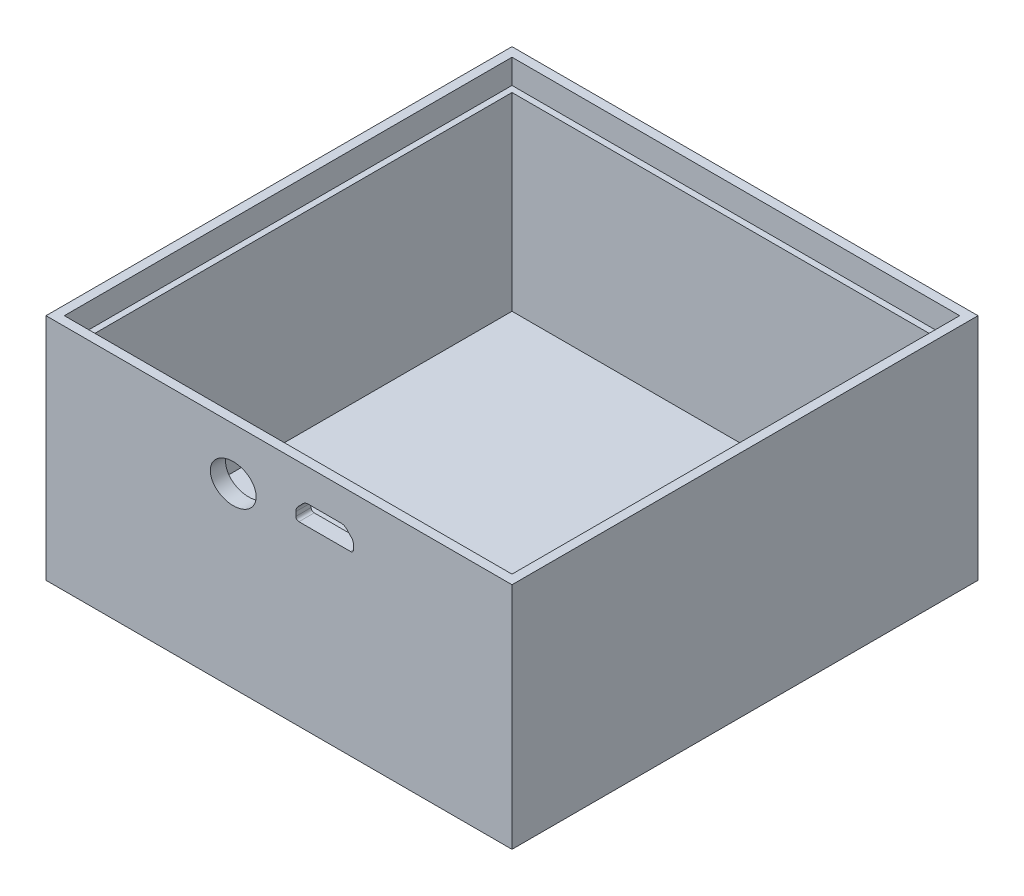
from build123d import *

# Parameters (mm, degrees)
SKETCH1_W           = 61
SKETCH1_H           = 61
SKETCH1_W_2         = 57
SKETCH1_H_2         = 57
BOSS_EXTRUDE2_DEPTH = 30
SKETCH2_W           = 58.6
SKETCH2_H           = 58.6
CUT_EXTRUDE1_DEPTH  = 3.2
SKETCH4_RX          = 3
SKETCH4_RY          = 2.5
CUT_EXTRUDE2_DEPTH  = 73.878323252
SKETCH5_W           = 57
SKETCH5_H           = 57
BOSS_EXTRUDE3_DEPTH = 2


with BuildPart() as part:
    # Sketch1 → Boss-Extrude2 (new body)
    with BuildSketch(Plane(origin=(0, 0, 0), x_dir=(1, 0, 0), z_dir=(0, 1, 0))):
        with Locations((0, 28.5)):
            Rectangle(SKETCH1_W, SKETCH1_H)
        with Locations((0, 28.5)):
            Rectangle(SKETCH1_W_2, SKETCH1_H_2, mode=Mode.SUBTRACT)
    extrude(amount=BOSS_EXTRUDE2_DEPTH)

    # Sketch2 → Cut-Extrude1 (cut)
    with BuildSketch(Plane(origin=(0, 30, 0), x_dir=(1, 0, 0), z_dir=(0, 1, 0))):
        with Locations((0, 28.5)):
            Rectangle(SKETCH2_W, SKETCH2_H)
    extrude(amount=-CUT_EXTRUDE1_DEPTH, mode=Mode.SUBTRACT)

    # Sketch4 → Cut-Extrude2 (cut, through all)
    with BuildSketch(Plane(origin=(0, 0, 0), x_dir=(-1, 0, 0), z_dir=(0, 0, -1))):
        with BuildLine():
            Line((-5.98277454, 23.2), (-5.98277454, 25.8))
            Line((-5.98277454, 25.8), (-8.131556664, 25.8))
            ThreePointArc((-8.131556664, 25.8), (-8.523646049, 25.719927124), (-8.852943985, 25.492531828))
            Line((-8.852943985, 25.492531828), (-9.479161861, 24.840221541))
            ThreePointArc((-9.479161861, 24.840221541), (-9.685510311, 24.520927357), (-9.75777454, 24.147689712))
            Line((-9.75777454, 24.147689712), (-9.75777454, 23.6))
            ThreePointArc((-9.75777454, 23.6), (-9.640617252, 23.317157288), (-9.35777454, 23.2))
            Line((-9.35777454, 23.2), (-5.98277454, 23.2))
        make_face()
        with BuildLine():
            Line((-3.833992416, 25.8), (-5.98277454, 25.8))
            Line((-5.98277454, 25.8), (-5.98277454, 23.2))
            Line((-5.98277454, 23.2), (-2.60777454, 23.2))
            ThreePointArc((-2.60777454, 23.2), (-2.324931828, 23.317157288), (-2.20777454, 23.6))
            Line((-2.20777454, 23.6), (-2.20777454, 24.147689712))
            ThreePointArc((-2.20777454, 24.147689712), (-2.280038769, 24.520927357), (-2.486387219, 24.840221541))
            Line((-2.486387219, 24.840221541), (-3.112605095, 25.492531828))
            ThreePointArc((-3.112605095, 25.492531828), (-3.441903031, 25.719927124), (-3.833992416, 25.8))
        make_face()
        with Locations(Location((5.992555786, 23.215339324), (0, 0, 180))):
            Ellipse(SKETCH4_RX, SKETCH4_RY)
    extrude(amount=-CUT_EXTRUDE2_DEPTH, mode=Mode.SUBTRACT)

    # Sketch5 → Boss-Extrude3 (add)
    with BuildSketch(Plane.XZ):
        with Locations((0, -28.5)):
            Rectangle(SKETCH5_W, SKETCH5_H)
    extrude(amount=-BOSS_EXTRUDE3_DEPTH)


solid = part.part
